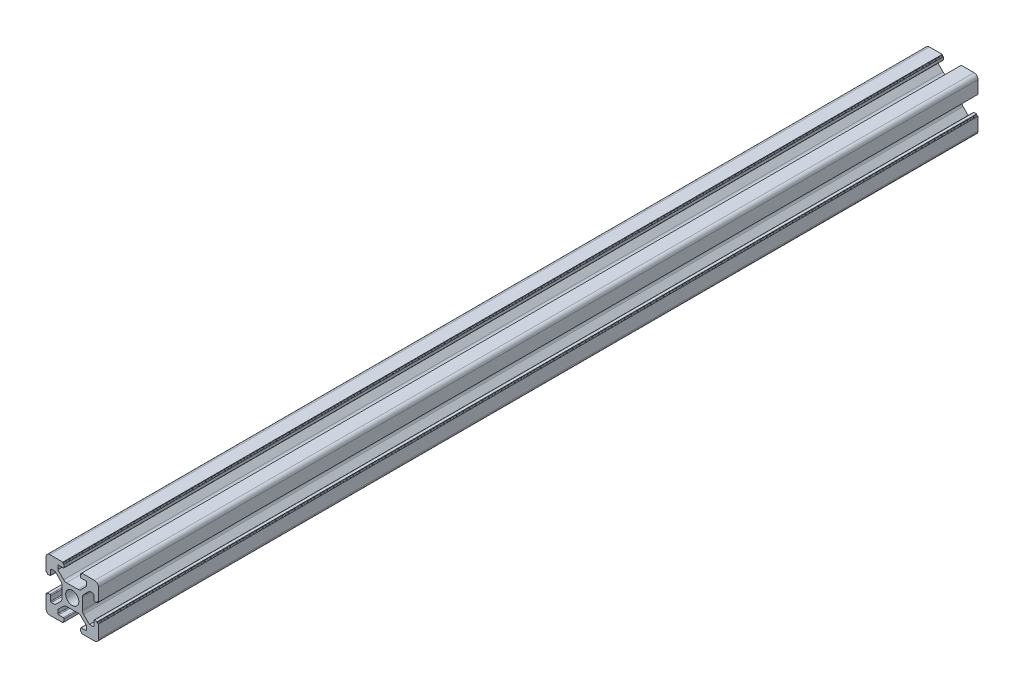
from build123d import *

# Parameters (mm, degrees)
SKETCH_1_R      = 2.5
EXTRUDE_1_DEPTH = 335


with BuildPart() as part:
    # 草图1 → 凸台-拉伸1 (new body)
    with BuildSketch(Plane.XY):
        with BuildLine():
            Line((4.215995631, 3.244230202), (6.436655803, 5.464890373))
            Line((6.436655803, 5.464890373), (7.776655803, 5.464890373))
            ThreePointArc((7.776655803, 5.464890373), (7.988787838, 5.377022408), (8.076655803, 5.164890373))
            Line((8.076655803, 5.164890373), (8.076655803, 3.364890373))
            ThreePointArc((8.076655803, 3.364890373), (8.164523769, 3.152758339), (8.376655803, 3.064890373))
            Line((8.376655803, 3.064890373), (9.376655803, 3.064890373))
            Line((9.376655803, 3.064890373), (9.376655803, 3.364890373))
            ThreePointArc((9.376655803, 3.364890373), (9.435234447, 3.50631173), (9.576655803, 3.564890373))
            Line((9.576655803, 3.564890373), (9.876655803, 3.564890373))
            Line((9.876655803, 3.564890373), (9.876655803, 8.464890373))
            ThreePointArc((9.876655803, 8.464890373), (9.437315975, 9.525550545), (8.376655803, 9.964890373))
            Line((8.376655803, 9.964890373), (3.476655803, 9.964890373))
            Line((3.476655803, 9.964890373), (3.476655803, 9.664890373))
            ThreePointArc((3.476655803, 9.664890373), (3.418077159, 9.523469017), (3.276655803, 9.464890373))
            Line((3.276655803, 9.464890373), (2.976655803, 9.464890373))
            Line((2.976655803, 9.464890373), (2.976655803, 8.464890373))
            ThreePointArc((2.976655803, 8.464890373), (3.064523769, 8.252758339), (3.276655803, 8.164890373))
            Line((3.276655803, 8.164890373), (5.076655803, 8.164890373))
            ThreePointArc((5.076655803, 8.164890373), (5.288787838, 8.077022408), (5.376655803, 7.864890373))
            Line((5.376655803, 7.864890373), (5.376655803, 6.524890373))
            Line((5.376655803, 6.524890373), (3.155995631, 4.304230202))
            ThreePointArc((3.155995631, 4.304230202), (2.669360608, 3.979071075), (2.09533546, 3.864890373))
            Line((2.09533546, 3.864890373), (-2.342023853, 3.864890373))
            ThreePointArc((-2.342023853, 3.864890373), (-2.916049002, 3.979071075), (-3.402684025, 4.304230202))
            Line((-3.402684025, 4.304230202), (-5.623344197, 6.524890373))
            Line((-5.623344197, 6.524890373), (-5.623344197, 7.864890373))
            ThreePointArc((-5.623344197, 7.864890373), (-5.535476231, 8.077022408), (-5.323344197, 8.164890373))
            Line((-5.323344197, 8.164890373), (-3.523344197, 8.164890373))
            ThreePointArc((-3.523344197, 8.164890373), (-3.311212162, 8.252758339), (-3.223344197, 8.464890373))
            Line((-3.223344197, 8.464890373), (-3.223344197, 9.464890373))
            Line((-3.223344197, 9.464890373), (-3.523344197, 9.464890373))
            ThreePointArc((-3.523344197, 9.464890373), (-3.664765553, 9.523469017), (-3.723344197, 9.664890373))
            Line((-3.723344197, 9.664890373), (-3.723344197, 9.964890373))
            Line((-3.723344197, 9.964890373), (-8.623344197, 9.964890373))
            ThreePointArc((-8.623344197, 9.964890373), (-9.684004369, 9.525550545), (-10.123344197, 8.464890373))
            Line((-10.123344197, 8.464890373), (-10.123344197, 3.564890373))
            Line((-10.123344197, 3.564890373), (-9.823344197, 3.564890373))
            ThreePointArc((-9.823344197, 3.564890373), (-9.681922841, 3.50631173), (-9.623344197, 3.364890373))
            Line((-9.623344197, 3.364890373), (-9.623344197, 3.064890373))
            Line((-9.623344197, 3.064890373), (-8.623344197, 3.064890373))
            ThreePointArc((-8.623344197, 3.064890373), (-8.411212162, 3.152758339), (-8.323344197, 3.364890373))
            Line((-8.323344197, 3.364890373), (-8.323344197, 5.164890373))
            ThreePointArc((-8.323344197, 5.164890373), (-8.235476231, 5.377022408), (-8.023344197, 5.464890373))
            Line((-8.023344197, 5.464890373), (-6.683344197, 5.464890373))
            Line((-6.683344197, 5.464890373), (-4.462684025, 3.244230202))
            ThreePointArc((-4.462684025, 3.244230202), (-4.137524898, 2.757595178), (-4.023344197, 2.18357003))
            Line((-4.023344197, 2.18357003), (-4.023344197, -2.253789283))
            ThreePointArc((-4.023344197, -2.253789283), (-4.137524898, -2.827814432), (-4.462684025, -3.314449455))
            Line((-4.462684025, -3.314449455), (-6.683344197, -5.535109627))
            Line((-6.683344197, -5.535109627), (-8.023344197, -5.535109627))
            ThreePointArc((-8.023344197, -5.535109627), (-8.235476231, -5.447241661), (-8.323344197, -5.235109627))
            Line((-8.323344197, -5.235109627), (-8.323344197, -3.435109627))
            ThreePointArc((-8.323344197, -3.435109627), (-8.411212162, -3.222977592), (-8.623344197, -3.135109627))
            Line((-8.623344197, -3.135109627), (-9.623344197, -3.135109627))
            Line((-9.623344197, -3.135109627), (-9.623344197, -3.435109627))
            ThreePointArc((-9.623344197, -3.435109627), (-9.681922841, -3.576530983), (-9.823344197, -3.635109627))
            Line((-9.823344197, -3.635109627), (-10.123344197, -3.635109627))
            Line((-10.123344197, -3.635109627), (-10.123344197, -8.535109627))
            ThreePointArc((-10.123344197, -8.535109627), (-9.684004369, -9.595769798), (-8.623344197, -10.035109627))
            Line((-8.623344197, -10.035109627), (-3.723344197, -10.035109627))
            Line((-3.723344197, -10.035109627), (-3.723344197, -9.735109627))
            ThreePointArc((-3.723344197, -9.735109627), (-3.664765553, -9.59368827), (-3.523344197, -9.535109627))
            Line((-3.523344197, -9.535109627), (-3.223344197, -9.535109627))
            Line((-3.223344197, -9.535109627), (-3.223344197, -8.535109627))
            ThreePointArc((-3.223344197, -8.535109627), (-3.311212162, -8.322977592), (-3.523344197, -8.235109627))
            Line((-3.523344197, -8.235109627), (-5.323344197, -8.235109627))
            ThreePointArc((-5.323344197, -8.235109627), (-5.535476231, -8.147241661), (-5.623344197, -7.935109627))
            Line((-5.623344197, -7.935109627), (-5.623344197, -6.595109627))
            Line((-5.623344197, -6.595109627), (-3.402684025, -4.374449455))
            ThreePointArc((-3.402684025, -4.374449455), (-2.916049002, -4.049290328), (-2.342023853, -3.935109627))
            Line((-2.342023853, -3.935109627), (2.09533546, -3.935109627))
            ThreePointArc((2.09533546, -3.935109627), (2.669360608, -4.049290328), (3.155995631, -4.374449455))
            Line((3.155995631, -4.374449455), (5.376655803, -6.595109627))
            Line((5.376655803, -6.595109627), (5.376655803, -7.935109627))
            ThreePointArc((5.376655803, -7.935109627), (5.288787838, -8.147241661), (5.076655803, -8.235109627))
            Line((5.076655803, -8.235109627), (3.276655803, -8.235109627))
            ThreePointArc((3.276655803, -8.235109627), (3.064523769, -8.322977592), (2.976655803, -8.535109627))
            Line((2.976655803, -8.535109627), (2.976655803, -9.535109627))
            Line((2.976655803, -9.535109627), (3.276655803, -9.535109627))
            ThreePointArc((3.276655803, -9.535109627), (3.418077159, -9.59368827), (3.476655803, -9.735109627))
            Line((3.476655803, -9.735109627), (3.476655803, -10.035109627))
            Line((3.476655803, -10.035109627), (8.376655803, -10.035109627))
            ThreePointArc((8.376655803, -10.035109627), (9.437315975, -9.595769798), (9.876655803, -8.535109627))
            Line((9.876655803, -8.535109627), (9.876655803, -3.635109627))
            Line((9.876655803, -3.635109627), (9.576655803, -3.635109627))
            ThreePointArc((9.576655803, -3.635109627), (9.435234447, -3.576530983), (9.376655803, -3.435109627))
            Line((9.376655803, -3.435109627), (9.376655803, -3.135109627))
            Line((9.376655803, -3.135109627), (8.376655803, -3.135109627))
            ThreePointArc((8.376655803, -3.135109627), (8.164523769, -3.222977592), (8.076655803, -3.435109627))
            Line((8.076655803, -3.435109627), (8.076655803, -5.235109627))
            ThreePointArc((8.076655803, -5.235109627), (7.988787838, -5.447241661), (7.776655803, -5.535109627))
            Line((7.776655803, -5.535109627), (6.436655803, -5.535109627))
            Line((6.436655803, -5.535109627), (4.215995631, -3.314449455))
            ThreePointArc((4.215995631, -3.314449455), (3.890836504, -2.827814432), (3.776655803, -2.253789283))
            Line((3.776655803, -2.253789283), (3.776655803, 2.18357003))
            ThreePointArc((3.776655803, 2.18357003), (3.890836504, 2.757595178), (4.215995631, 3.244230202))
        make_face()
        with Locations((-0.123344197, -0.035109627)):
            Circle(SKETCH_1_R, mode=Mode.SUBTRACT)
    extrude(amount=EXTRUDE_1_DEPTH)


solid = part.part
